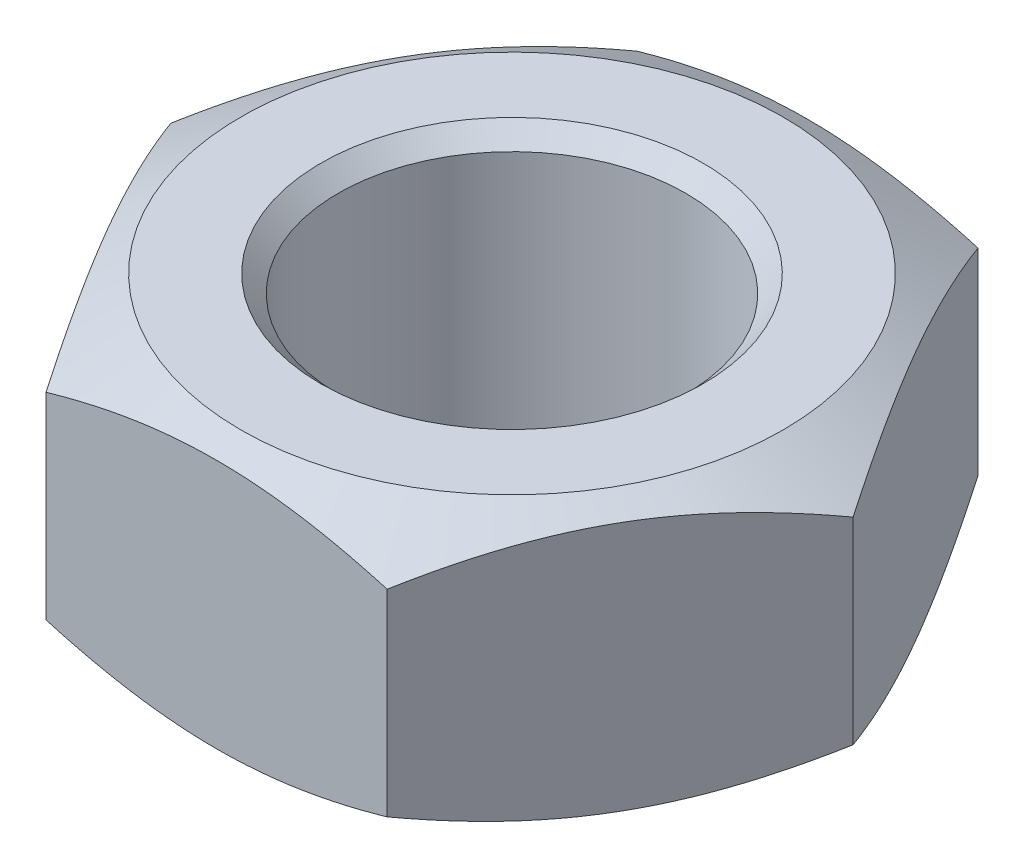
from build123d import *

# Parameters (mm, degrees)
EXTRUDE_1_DEPTH     = 8
SKETCH_5_R          = 5
CUT_EXTRUDE_1_DEPTH = 16.250683045
CHAMFER_1_SIZE      = 0.5


with BuildPart() as part:
    # Эскиз1 → Вытянуть1 (new body)
    with BuildSketch(Plane(origin=(0, 0, 0), x_dir=(1, 0, 0), z_dir=(0, 1, 0))):
        Polygon((-4.907477288, 8.5), (4.907477288, 8.5), (9.814954576, 0), (4.907477288, -8.5), (-4.907477288, -8.5), (-9.814954576, 0), align=None)
    extrude(amount=-EXTRUDE_1_DEPTH)

    # Эскиз5 → Вырез-Вытянуть1 (cut, through all)
    with BuildSketch(Plane.XZ.offset(8)):
        with Locations(Location((0, 0, 0), (0, 0, 270))):
            Circle(SKETCH_5_R)
    extrude(amount=-CUT_EXTRUDE_1_DEPTH, mode=Mode.SUBTRACT)

    # Эскиз4 → Вырез-Повернуть1 (revolve, cut)
    with BuildSketch(Plane.XY, mode=Mode.PRIVATE) as cut_revolve_1_sk:
        Polygon((-9.814954576, -1.163334567), (-7.8, 0), (-9.814954576, 0), align=None)
        Polygon((-9.814954576, -6.836665433), (-7.8, -8), (-9.814954576, -8), align=None)
    revolve(cut_revolve_1_sk.sketch.rotate(Axis((0, 0, 0), (0, -1, 0)), 120.000000007), axis=Axis((0, 0, 0), (0, -1, 0)), mode=Mode.SUBTRACT)

    # Фаска1
    chamfer_1_edges = [part.edges().sort_by_distance(p)[0] for p in [
        (0, 0, 5),
        (0, -8, 5),
    ]]
    chamfer(chamfer_1_edges, length=CHAMFER_1_SIZE)


solid = part.part
